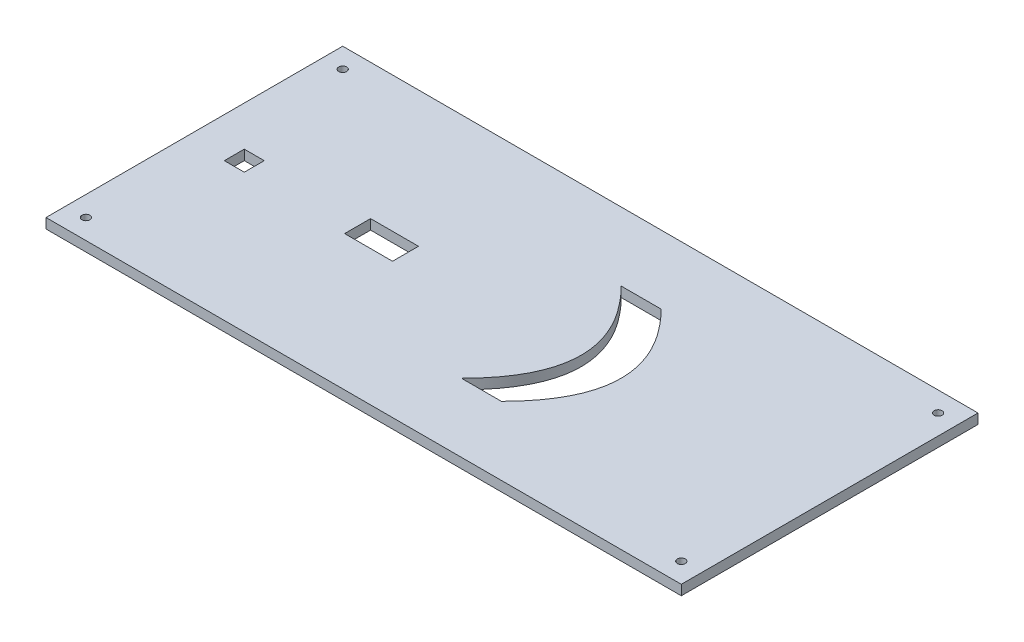
from build123d import *

# Parameters (mm, degrees)
ESQUISSE2_W             = 318.15
ESQUISSE2_H             = 148.59
BOSS_EXTRU_1_DEPTH      = 5
ESQUISSE3_R             = 2
ENL_V_MAT_EXTRU_1_DEPTH = 5
ENL_V_MAT_EXTRU_2_DEPTH = 5
ENL_V_MAT_EXTRU_3_DEPTH = 5
ESQUISSE7_W             = 10
ESQUISSE7_H             = 10
ENL_V_MAT_EXTRU_4_DEPTH = 5


with BuildPart() as part:
    # Esquisse2 → Boss.-Extru.1 (new body)
    with BuildSketch(Plane(origin=(0, 0, 0), x_dir=(1, 0, 0), z_dir=(0, 1, 0))):
        with Locations((127.309454852, -77.182817805)):
            Rectangle(ESQUISSE2_W, ESQUISSE2_H)
    extrude(amount=BOSS_EXTRU_1_DEPTH)

    # Esquisse3 → Enlèv. mat.-Extru.1 (cut)
    with BuildSketch(Plane(origin=(0, 5, 0), x_dir=(1, 0, 0), z_dir=(0, 1, 0))):
        with Locations(Location((276.384454852, -141.477817805, 0), (0, 0, 270))):
            Circle(ESQUISSE3_R)
        with Locations(Location((276.384454852, -12.887817805, 0), (0, 0, 270))):
            Circle(ESQUISSE3_R)
        with Locations(Location((-21.765545148, -12.887817805, 0), (0, 0, 270))):
            Circle(ESQUISSE3_R)
        with Locations(Location((-21.765545148, -141.477817805, 0), (0, 0, 270))):
            Circle(ESQUISSE3_R)
    extrude(amount=-ENL_V_MAT_EXTRU_1_DEPTH, mode=Mode.SUBTRACT)

    # Esquisse4 → Enlèv. mat.-Extru.2 (cut)
    with BuildSketch(Plane(origin=(0, 5, 0), x_dir=(1, 0, 0), z_dir=(0, 1, 0))):
        Polygon((73.982481978, -83.682817805), (73.982481978, -77.182817805), (56.982481978, -77.182817805), (49.982481978, -77.182817805), (49.982481978, -83.682817805), align=None)
        Polygon((56.982481978, -77.182817805), (73.982481978, -77.182817805), (73.982481978, -70.682817805), (49.982481978, -70.682817805), (49.982481978, -77.182817805), align=None)
    extrude(amount=-ENL_V_MAT_EXTRU_2_DEPTH, mode=Mode.SUBTRACT)

    # Esquisse6 → Enlèv. mat.-Extru.3 (cut)
    with BuildSketch(Plane(origin=(0, 0, 0), x_dir=(-1, 0, 0), z_dir=(0, -1, 0))):
        with BuildLine():
            Line((-161.982481978, -37.182817805), (-141.982481978, -37.182817805))
            add(Edge.make_bspline(
                [(-141.982481978, -117.182817805), (-181.982481978, -77.182817805), (-141.982481978, -37.182817805)],
                knots=[0, 0, 0, 1, 1, 1], degree=2))
            Line((-141.982481978, -117.182817805), (-161.982481978, -117.182817805))
            add(Edge.make_bspline(
                [(-161.982481978, -117.182817805), (-201.982481978, -77.182817805), (-161.982481978, -37.182817805)],
                knots=[0, 0, 0, 1, 1, 1], degree=2))
        make_face()
    extrude(amount=-ENL_V_MAT_EXTRU_3_DEPTH, mode=Mode.SUBTRACT)

    # Esquisse7 → Enlèv. mat.-Extru.4 (cut)
    with BuildSketch(Plane(origin=(0, 0, 0), x_dir=(-1, 0, 0), z_dir=(0, -1, 0))):
        with Locations((6.765545148, -77.182817805)):
            Rectangle(ESQUISSE7_W, ESQUISSE7_H)
    extrude(amount=-ENL_V_MAT_EXTRU_4_DEPTH, mode=Mode.SUBTRACT)


solid = part.part
